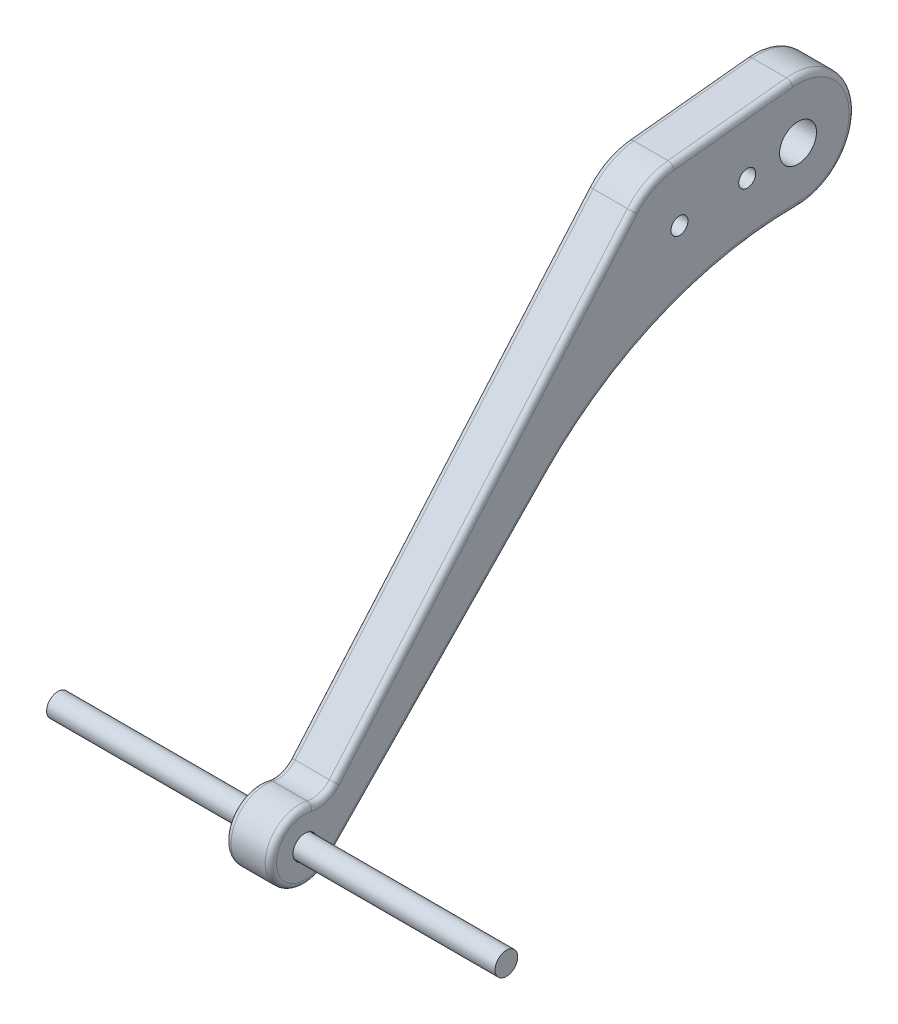
from build123d import *

# Parameters (mm, degrees)
ESQUISSE3_R             = 2
BOSS_EXTRU_1_DEPTH      = 39.5
ESQUISSE5_R             = 3.25
ESQUISSE5_R_2           = 2.1
ESQUISSE5_R_3           = 1.5
BOSS_EXTRU_2_DEPTH      = 4
CONG_1_R                = 4
CONG_2_R                = 1
ENL_V_MAT_EXTRU_1_DEPTH = 3


with BuildPart() as part:
    # Esquisse3 → Boss.-Extru.1 (new, symmetric)
    with BuildSketch(Plane(origin=(0, 0, 0), x_dir=(0, 0, -1), z_dir=(1, 0, 0))):
        with Locations((-86.878738339, -64)):
            Circle(ESQUISSE3_R)
    extrude(amount=BOSS_EXTRU_1_DEPTH, both=True)


with BuildPart() as body_2:
    # Esquisse5 → Boss.-Extru.2 (new, symmetric)
    with BuildSketch(Plane(origin=(0, 0, 0), x_dir=(0, 0, -1), z_dir=(1, 0, 0))):
        with BuildLine():
            Line((-83.469999177, -59.062338881), (-29.083614474, 4.008168523))
            ThreePointArc((-29.083614474, 4.008168523), (-25.864077947, 6.561894104), (-21.930244435, 7.750121225))
            Line((-21.930244435, 7.750121225), (-1.045284633, 9.945218954))
            ThreePointArc((-1.045284633, 9.945218954), (9.986295348, 0.523359562), (0, -10))
            ThreePointArc((0, -10), (-23.924437635, -14.844274042), (-44.079882353, -28.613941988))
            Line((-44.079882353, -28.613941988), (-82.578262012, -68.18400566))
            ThreePointArc((-82.578262012, -68.18400566), (-92.850270978, -64.583779009), (-83.469999177, -59.062338881))
        make_face()
        Circle(ESQUISSE5_R, mode=Mode.SUBTRACT)
        with Locations((-86.878738339, -64)):
            Circle(ESQUISSE5_R_2, mode=Mode.SUBTRACT)
        with Locations((-8.950697058, -0.940756169)):
            Circle(ESQUISSE5_R_3, mode=Mode.SUBTRACT)
        with Locations((-20.884959803, -2.195097729)):
            Circle(ESQUISSE5_R_3, mode=Mode.SUBTRACT)
    extrude(amount=BOSS_EXTRU_2_DEPTH, both=True)

    # Congé1
    cong_1_edges = [body_2.edges().sort_by_distance(p)[0] for p in [
        (0, -59.062338881, 83.469999177),
    ]]
    fillet(cong_1_edges, radius=CONG_1_R)

    # Congé2
    cong_2_edges = [body_2.edges().sort_by_distance(p)[0] for p in [
        (4, -14.844274042, 23.924437635),
        (4, 0.523359562, -9.986295348),
        (4, 8.847670089, 11.487764534),
        (4, 6.561894104, 25.864077947),
        (4, -26.432255243, 55.33272306),
        (-4, -65.688015825, 92.636394335),
        (4, -65.688015825, 92.636394335),
        (-4, -58.063409395, 83.370995654),
        (4, -58.063409395, 83.370995654),
        (-4, -26.432255243, 55.33272306),
        (4, -48.398973824, 63.329072182),
        (-4, 6.561894104, 25.864077947),
        (-4, 8.847670089, 11.487764534),
        (-4, 0.523359562, -9.986295348),
        (-4, -14.844274042, 23.924437635),
        (-4, -48.398973824, 63.329072182),
    ]]
    fillet(cong_2_edges, radius=CONG_2_R)

    # Esquisse6 → Enlèv. mat.-Extru.1 (cut)
    with BuildSketch(Plane.ZY.offset(4)):
        with BuildLine():
            Line((0.679435011, 6.46439232), (20.569872919, 4.373823055))
            ThreePointArc((20.569872919, 4.373823055), (26.354830227, -2.770004277), (19.211002896, -8.554961585))
            Line((19.211002896, -8.554961585), (-0.679435011, -6.46439232))
            ThreePointArc((-0.679435011, -6.46439232), (-6.46439232, 0.679435011), (0.679435011, 6.46439232))
        make_face()
    extrude(amount=-ENL_V_MAT_EXTRU_1_DEPTH, mode=Mode.SUBTRACT)


solid = Compound([part.part, body_2.part])
